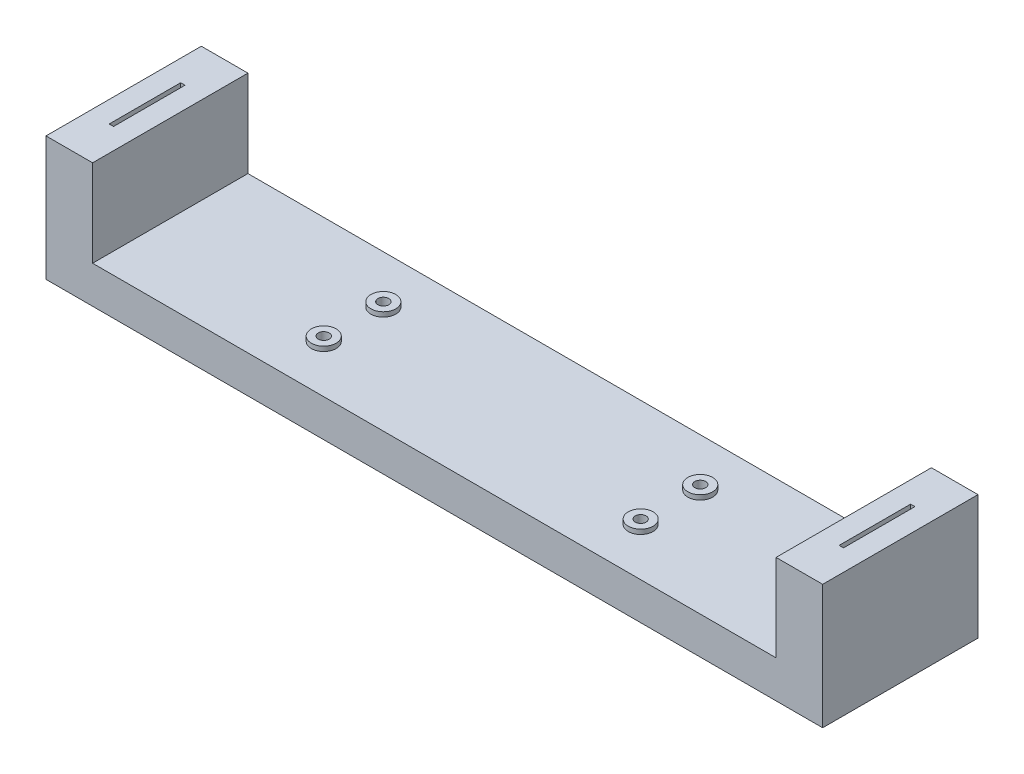
from build123d import *

# Parameters (mm, degrees)
SKETCH1_W           = 15
SKETCH1_H           = 50
BOSS_EXTRUDE1_DEPTH = 40
BOSS_EXTRUDE2_DEPTH = 40
SKETCH1_6_R         = 1.75
BOSS_EXTRUDE3_DEPTH = 12
SKETCH2_W           = 1.4
SKETCH2_H           = 23
CUT_EXTRUDE1_DEPTH  = 30
SKETCH3_W           = 1.4
SKETCH3_H           = 23
CUT_EXTRUDE2_DEPTH  = 30
SKETCH4_R           = 1.75
CUT_EXTRUDE5_DEPTH  = 25
SKETCH5_R           = 4
SKETCH5_R_2         = 1.75
BOSS_EXTRUDE4_DEPTH = 1.5
SKETCH6_R           = 4
SKETCH6_R_2         = 1.75
BOSS_EXTRUDE5_DEPTH = 1.5


with BuildPart() as part:
    # Sketch1 → Boss-Extrude1 (new body)
    with BuildSketch(Plane(origin=(0, 0, 0), x_dir=(1, 0, 0), z_dir=(0, 1, 0))):
        with Locations((-117.5, 0)):
            Rectangle(SKETCH1_W, SKETCH1_H)
    extrude(amount=BOSS_EXTRUDE1_DEPTH)



with BuildPart() as body_2:
    # Sketch1<4> → Boss-Extrude2 (new body)
    with BuildSketch(Plane(origin=(0, 0, 0), x_dir=(1, 0, 0), z_dir=(0, 1, 0))):
        Polygon((125, 25), (110, 25), (110, 0), (110, -25), (125, -25), align=None)
    extrude(amount=BOSS_EXTRUDE2_DEPTH)


with BuildPart() as part_1:
    add(part.part)

    add(body_2.part)  # Boss-Extrude3 merges body 2
    # Sketch1<6> → Boss-Extrude3 (add)
    with BuildSketch(Plane(origin=(0, 0, 0), x_dir=(1, 0, 0), z_dir=(0, 1, 0))):
        Polygon((110, 25), (-110, 25), (-110, -25), (110, -25), (110, 0), align=None)
        with Locations((-51.006782466, -9.590411403)):
            Circle(SKETCH1_6_R, mode=Mode.SUBTRACT)
        with Locations((51.006782466, -9.590411403)):
            Circle(SKETCH1_6_R, mode=Mode.SUBTRACT)
        with Locations((51.006782466, 9.590411403)):
            Circle(SKETCH1_6_R, mode=Mode.SUBTRACT)
    extrude(amount=BOSS_EXTRUDE3_DEPTH)

    # Sketch2 → Cut-Extrude1 (cut)
    with BuildSketch(Plane(origin=(0, 40, 0), x_dir=(1, 0, 0), z_dir=(0, 1, 0))):
        with Locations((-117.45, 0)):
            Rectangle(SKETCH2_W, SKETCH2_H)
    extrude(amount=-CUT_EXTRUDE1_DEPTH, mode=Mode.SUBTRACT)

    # Sketch3 → Cut-Extrude2 (cut)
    with BuildSketch(Plane(origin=(0, 40, 0), x_dir=(1, 0, 0), z_dir=(0, 1, 0))):
        with Locations((117.5, 0)):
            Rectangle(SKETCH3_W, SKETCH3_H)
    extrude(amount=-CUT_EXTRUDE2_DEPTH, mode=Mode.SUBTRACT)

    # Sketch4 → Cut-Extrude5 (cut)
    with BuildSketch(Plane(origin=(0, 12, 0), x_dir=(1, 0, 0), z_dir=(0, 1, 0))):
        with Locations((-51.006782466, 9.590411403)):
            Circle(SKETCH4_R)
    extrude(amount=-CUT_EXTRUDE5_DEPTH, mode=Mode.SUBTRACT)

    # Sketch5 → Boss-Extrude4 (add)
    with BuildSketch(Plane(origin=(0, 12, 0), x_dir=(1, 0, 0), z_dir=(0, 1, 0))):
        with Locations((-51.006782466, -9.590411403)):
            Circle(SKETCH5_R)
        with Locations((-51.006782466, -9.590411403)):
            Circle(SKETCH5_R_2, mode=Mode.SUBTRACT)
    extrude(amount=BOSS_EXTRUDE4_DEPTH)

    # Sketch6 → Boss-Extrude5 (add)
    # profile 1 of 3: a face of its own
    with BuildSketch(Plane(origin=(0, 12, 0), x_dir=(1, 0, 0), z_dir=(0, 1, 0))):
        with Locations((-51.006782466, 9.590411403)):
            Circle(SKETCH6_R)
        with Locations((-51.006782466, 9.590411403)):
            Circle(SKETCH6_R_2, mode=Mode.SUBTRACT)
    # profile 2 of 3: a face of its own
    with BuildSketch(Plane(origin=(0, 12, 0), x_dir=(1, 0, 0), z_dir=(0, 1, 0))):
        with Locations((51.006782466, 9.590411403)):
            Circle(SKETCH6_R)
        with Locations((51.006782466, 9.590411403)):
            Circle(SKETCH6_R_2, mode=Mode.SUBTRACT)
    # profile 3 of 3: a face of its own
    with BuildSketch(Plane(origin=(0, 12, 0), x_dir=(1, 0, 0), z_dir=(0, 1, 0))):
        with Locations((51.006782466, -9.590411403)):
            Circle(SKETCH6_R)
        with Locations((51.006782466, -9.590411403)):
            Circle(SKETCH6_R_2, mode=Mode.SUBTRACT)
    extrude(amount=BOSS_EXTRUDE5_DEPTH)


solid = part_1.part
